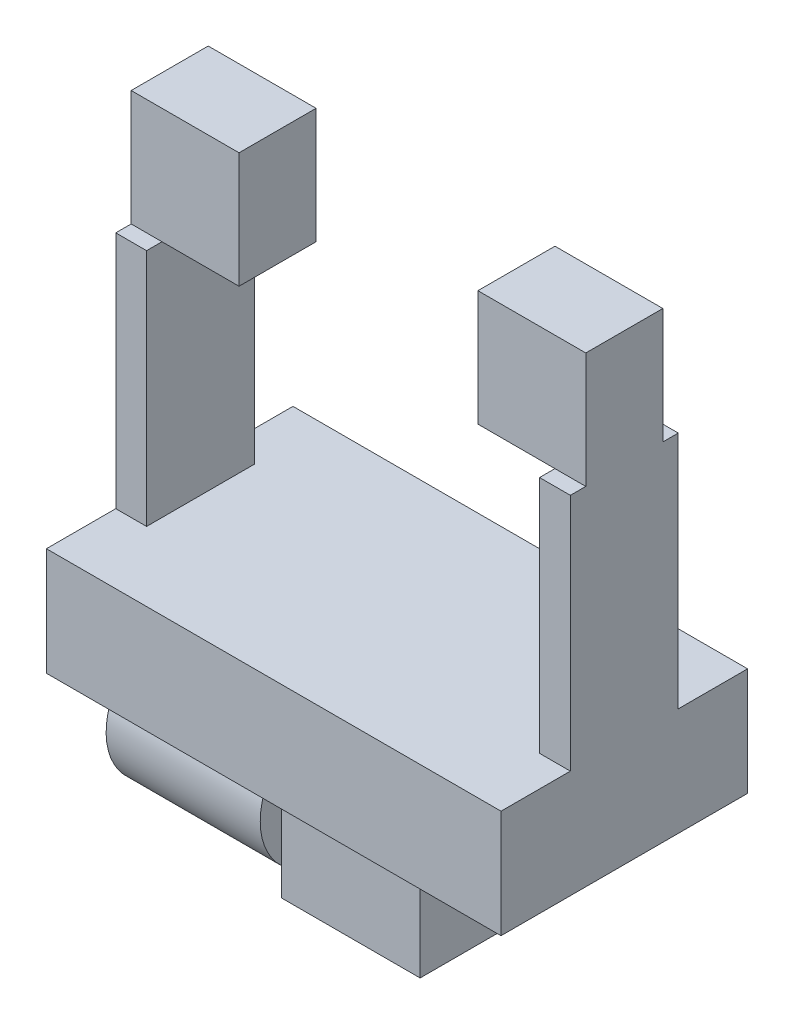
from build123d import *

# Parameters (mm, degrees)
SKETCH1_W           = 74.93
SKETCH1_H           = 17.78
BOSS_EXTRUDE1_DEPTH = 20.32
SKETCH2_W           = 5.08
SKETCH2_H           = 39.37
BOSS_EXTRUDE2_DEPTH = 8.89
SKETCH3_W           = 17.78
SKETCH3_H           = 19.05
BOSS_EXTRUDE3_DEPTH = 6.35
SKETCH5_W           = 22.86
SKETCH5_H           = 25.4
BOSS_EXTRUDE4_DEPTH = 7.62
SKETCH6_R           = 11.1125
BOSS_EXTRUDE5_DEPTH = 25.4


with BuildPart() as part:
    # Sketch1 → Boss-Extrude1 (new, symmetric)
    with BuildSketch(Plane.XY):
        Rectangle(SKETCH1_W, SKETCH1_H)
    extrude(amount=BOSS_EXTRUDE1_DEPTH, both=True)

    # Sketch2 → Boss-Extrude2 (add, symmetric)
    with BuildSketch(Plane.XY):
        with Locations((-34.925, 28.575)):
            Rectangle(SKETCH2_W, SKETCH2_H)
        with Locations((34.925, 28.575)):
            Rectangle(SKETCH2_W, SKETCH2_H)
    extrude(amount=BOSS_EXTRUDE2_DEPTH, both=True)

    # Sketch3 → Boss-Extrude3 (add, symmetric)
    with BuildSketch(Plane.XY):
        with Locations((28.575, 57.785)):
            Rectangle(SKETCH3_W, SKETCH3_H)
        with Locations((-28.575, 57.785)):
            Rectangle(SKETCH3_W, SKETCH3_H)
    extrude(amount=BOSS_EXTRUDE3_DEPTH, both=True)

    # Sketch5 → Boss-Extrude4 (add, symmetric)
    with BuildSketch(Plane.XY):
        with Locations((0, -21.59)):
            Rectangle(SKETCH5_W, SKETCH5_H)
    extrude(amount=BOSS_EXTRUDE4_DEPTH, both=True)

    # Sketch6 → Boss-Extrude5 (add)
    with BuildSketch(Plane.ZY.offset(11.43)):
        with Locations(Location((0, -21.59, 0), (0, 0, 46.708192407))):
            Circle(SKETCH6_R)
    extrude(amount=BOSS_EXTRUDE5_DEPTH)


solid = part.part
